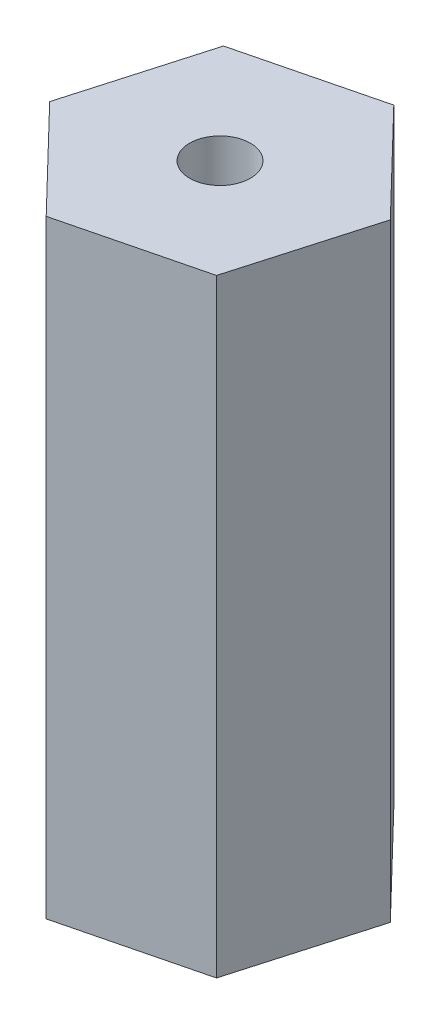
from build123d import *

# Parameters (mm, degrees)
RESSALTO_EXTRUS_O1_DEPTH = 30
ESBO_O2_R                = 1.5
CORTE_EXTRUS_O1_DEPTH    = 30


with BuildPart() as part:
    # Esboço1 → Ressalto-extrusão1 (new body)
    with BuildSketch(Plane(origin=(0, 0, 0), x_dir=(1, 0, 0), z_dir=(0, 1, 0))):
        Polygon((4.812291954, -4.984159523), (6.72255474, 1.675487321), (1.910262787, 6.659646844), (-4.812291954, 4.984159523), (-6.72255474, -1.675487321), (-1.910262787, -6.659646844), align=None)
    extrude(amount=RESSALTO_EXTRUS_O1_DEPTH)

    # Esboço2 → Corte-extrusão1 (cut)
    with BuildSketch(Plane.XZ):
        with Locations(Location((0, 0, 0), (0, 0, 270))):
            Circle(ESBO_O2_R)
    extrude(amount=-CORTE_EXTRUS_O1_DEPTH, mode=Mode.SUBTRACT)


solid = part.part
